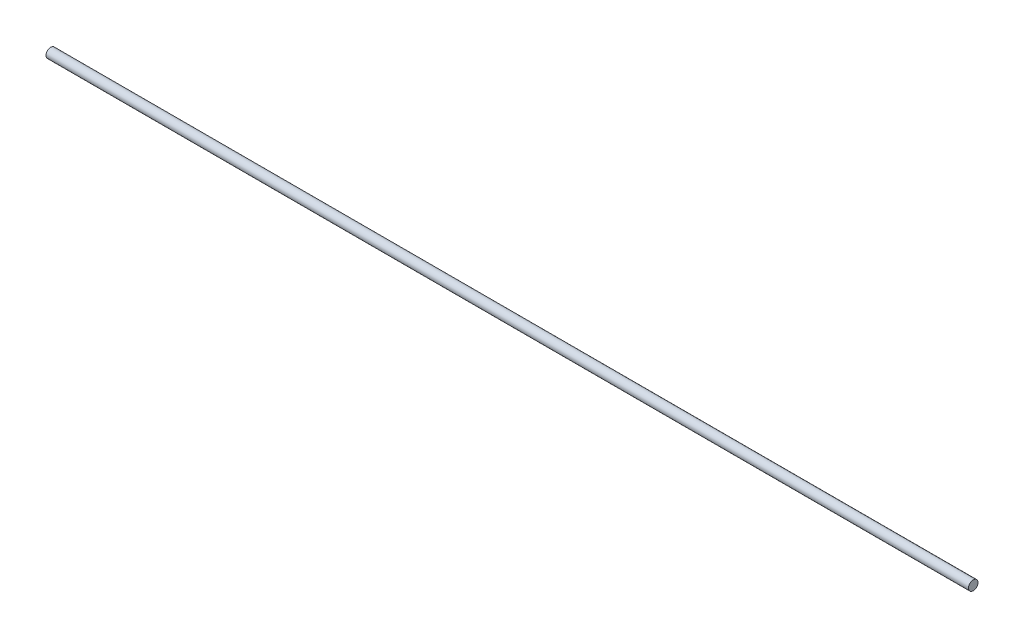
from build123d import *

# Parameters (mm, degrees)
SKETCH1_R           = 3.15
BOSS_EXTRUDE1_DEPTH = 306.5


with BuildPart() as part:
    # Sketch1 → Boss-Extrude1 (new, symmetric)
    with BuildSketch(Plane(origin=(0, 0, 0), x_dir=(0, 0, -1), z_dir=(1, 0, 0))):
        Circle(SKETCH1_R)
    extrude(amount=BOSS_EXTRUDE1_DEPTH, both=True)


solid = part.part
